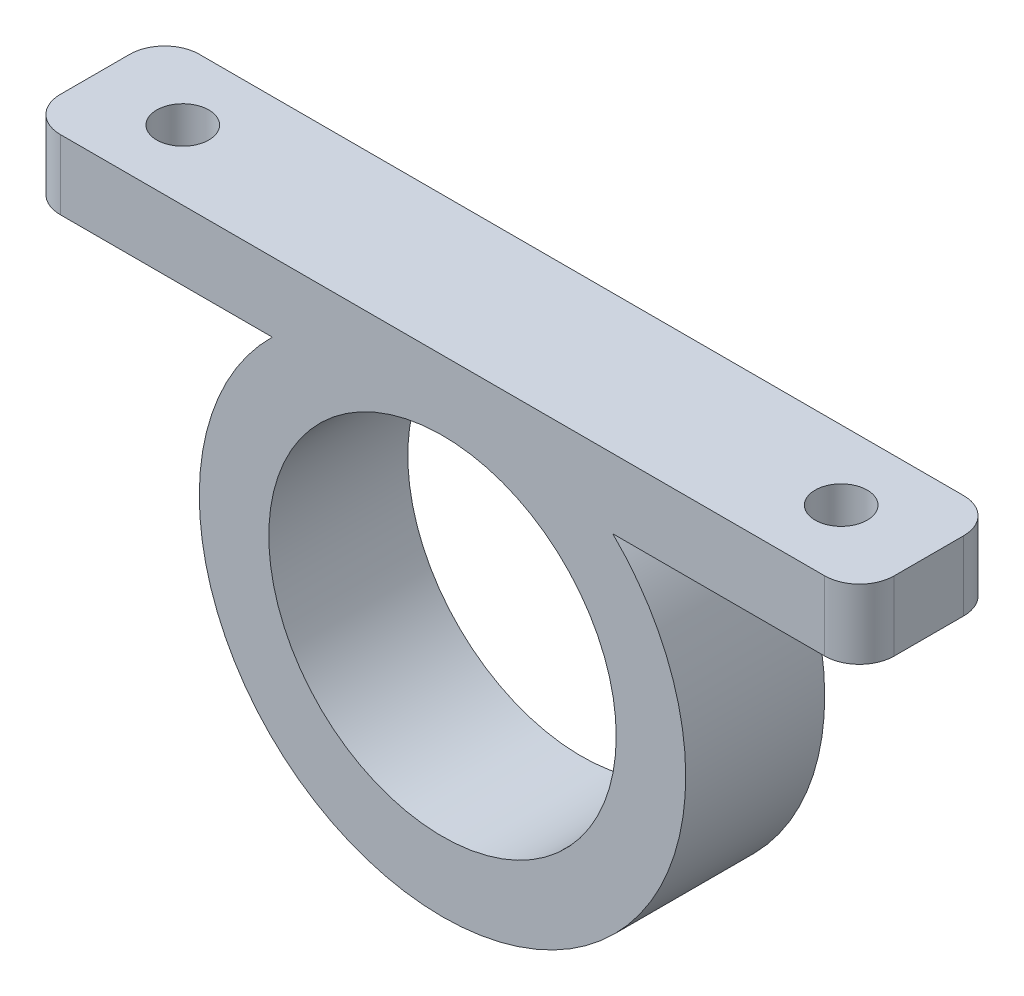
from build123d import *

# Parameters (mm, degrees)
CROQUIS1_R              = 10
SALIENTE_EXTRUIR1_DEPTH = 8
REDONDEO1_R             = 2
CROQUIS2_R              = 1.5
CORTAR_EXTRUIR1_DEPTH   = 35.871191548


with BuildPart() as part:
    # Croquis1 → Saliente-Extruir1 (new body)
    with BuildSketch(Plane.XY):
        with BuildLine():
            Line((0, 14), (24, 14))
            Line((24, 14), (24, 10))
            Line((24, 10), (9.797958971, 10))
            ThreePointArc((9.797958971, 10), (0, -14), (-9.797958971, 10))
            Line((-9.797958971, 10), (-24, 10))
            Line((-24, 10), (-24, 14))
            Line((-24, 14), (0, 14))
        make_face()
        Circle(CROQUIS1_R, mode=Mode.SUBTRACT)
    extrude(amount=SALIENTE_EXTRUIR1_DEPTH)

    # Redondeo1
    redondeo1_edges = [part.edges().sort_by_distance(p)[0] for p in [
        (24, 12, 8),
        (-24, 12, 8),
        (-24, 12, 0),
        (24, 12, 0),
    ]]
    fillet(redondeo1_edges, radius=REDONDEO1_R)

    # Croquis2 → Cortar-Extruir1 (cut, through all)
    with BuildSketch(Plane.XZ.offset(-10)):
        with Locations(Location((-18.949489743, 4, 0), (0, 0, 270))):
            Circle(CROQUIS2_R)
        with Locations(Location((18.949489743, 4, 0), (0, 0, 270))):
            Circle(CROQUIS2_R)
    extrude(amount=-CORTAR_EXTRUIR1_DEPTH, mode=Mode.SUBTRACT)


solid = part.part
